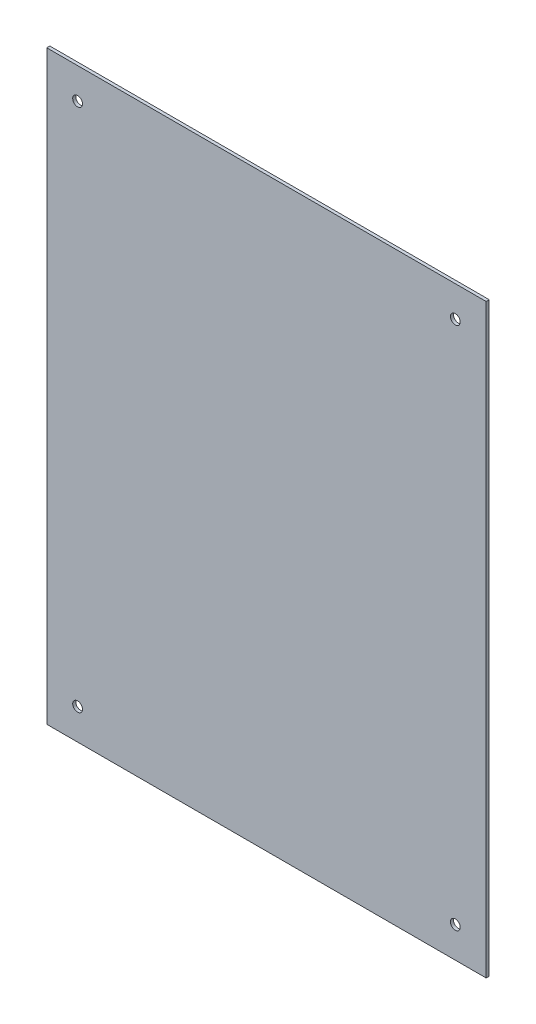
from build123d import *

# Parameters (mm, degrees)
CROQUIS1_W              = 285
CROQUIS1_H              = 380
SALIENTE_EXTRUIR1_DEPTH = 2
CROQUIS2_R              = 3.175
CORTAR_EXTRUIR1_DEPTH   = 10


with BuildPart() as part:
    # Croquis1 → Saliente-Extruir1 (new body)
    with BuildSketch(Plane.XY):
        with Locations((62.5, 218)):
            Rectangle(CROQUIS1_W, CROQUIS1_H)
    extrude(amount=SALIENTE_EXTRUIR1_DEPTH)

    # Croquis2 → Cortar-Extruir1 (cut)
    with BuildSketch(Plane.XY.offset(2)):
        with Locations((-60, 388)):
            Circle(CROQUIS2_R)
        with Locations((185, 388)):
            Circle(CROQUIS2_R)
        with Locations((185, 48)):
            Circle(CROQUIS2_R)
        with Locations((-60, 48)):
            Circle(CROQUIS2_R)
    extrude(amount=-CORTAR_EXTRUIR1_DEPTH, mode=Mode.SUBTRACT)


solid = part.part
